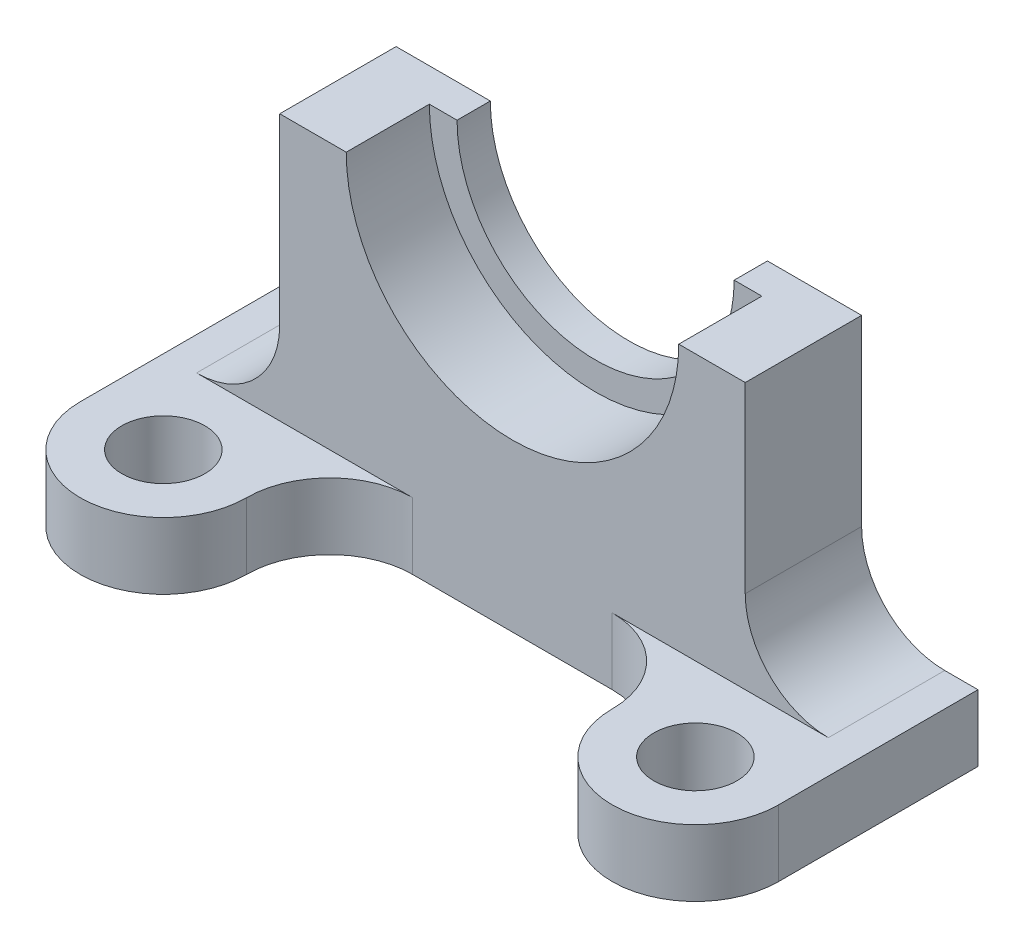
from build123d import *

# Parameters (mm, degrees)
SKETCH_1_R          = 15
EXTRUDE_1_DEPTH     = 24
SKETCH_3_W          = 168
SKETCH_3_H          = 96
EXTRUDE_2_DEPTH     = 42
SKETCH_4_R          = 60
CUT_EXTRUDE_1_DEPTH = 30
SKETCH_5_R          = 50
CUT_EXTRUDE_2_DEPTH = 30
FILLET_1_R          = 30


with BuildPart() as part:
    # 草圖1 → 填料-伸長1 (new body)
    # profile 1 of 2: a face of its own
    with BuildSketch(Plane(origin=(0, 0, 0), x_dir=(1, 0, 0), z_dir=(0, 1, 0))):
        with BuildLine():
            Line((252, 72), (126, 72))
            Line((126, 72), (126, 30))
            Line((126, 30), (162, 30))
            ThreePointArc((162, 30), (183.213203436, 21.213203436), (192, 0))
            ThreePointArc((192, 0), (222, -30), (252, 0))
            Line((252, 0), (252, 72))
        make_face()
        with Locations(Location((222, 0, 0), (0, 0, 270))):
            Circle(SKETCH_1_R, mode=Mode.SUBTRACT)
    # profile 2 of 2: a face of its own
    with BuildSketch(Plane(origin=(0, 0, 0), x_dir=(1, 0, 0), z_dir=(0, 1, 0))):
        with BuildLine():
            Line((0, 72), (0, 0))
            ThreePointArc((0, 0), (30, -30), (60, 0))
            ThreePointArc((60, 0), (68.786796564, 21.213203436), (90, 30))
            Line((90, 30), (126, 30))
            Line((126, 30), (126, 72))
            Line((126, 72), (0, 72))
        make_face()
        with Locations(Location((30, 0, 0), (0, 0, 270))):
            Circle(SKETCH_1_R, mode=Mode.SUBTRACT)
    extrude(amount=EXTRUDE_1_DEPTH)

    # 草圖3 → 填料-伸長2 (add)
    with BuildSketch(Plane(origin=(0, 0, -72), x_dir=(-1, 0, 0), z_dir=(0, 0, -1))):
        with Locations((-126, 72)):
            Rectangle(SKETCH_3_W, SKETCH_3_H)
    extrude(amount=-EXTRUDE_2_DEPTH)

    # 草圖4 → 除料-伸長1 (cut)
    with BuildSketch(Plane.XY.offset(-30)):
        with Locations((126, 120)):
            Circle(SKETCH_4_R)
    extrude(amount=-CUT_EXTRUDE_1_DEPTH, mode=Mode.SUBTRACT)

    # 草圖5 → 除料-伸長2 (cut)
    with BuildSketch(Plane.XY.offset(-60)):
        with Locations((126, 120)):
            Circle(SKETCH_5_R)
    extrude(amount=-CUT_EXTRUDE_2_DEPTH, mode=Mode.SUBTRACT)

    # 圓角1
    fillet_1_edges = [part.edges().sort_by_distance(p)[0] for p in [
        (42, 24, -51),
        (210, 24, -51),
    ]]
    fillet(fillet_1_edges, radius=FILLET_1_R)


solid = part.part
